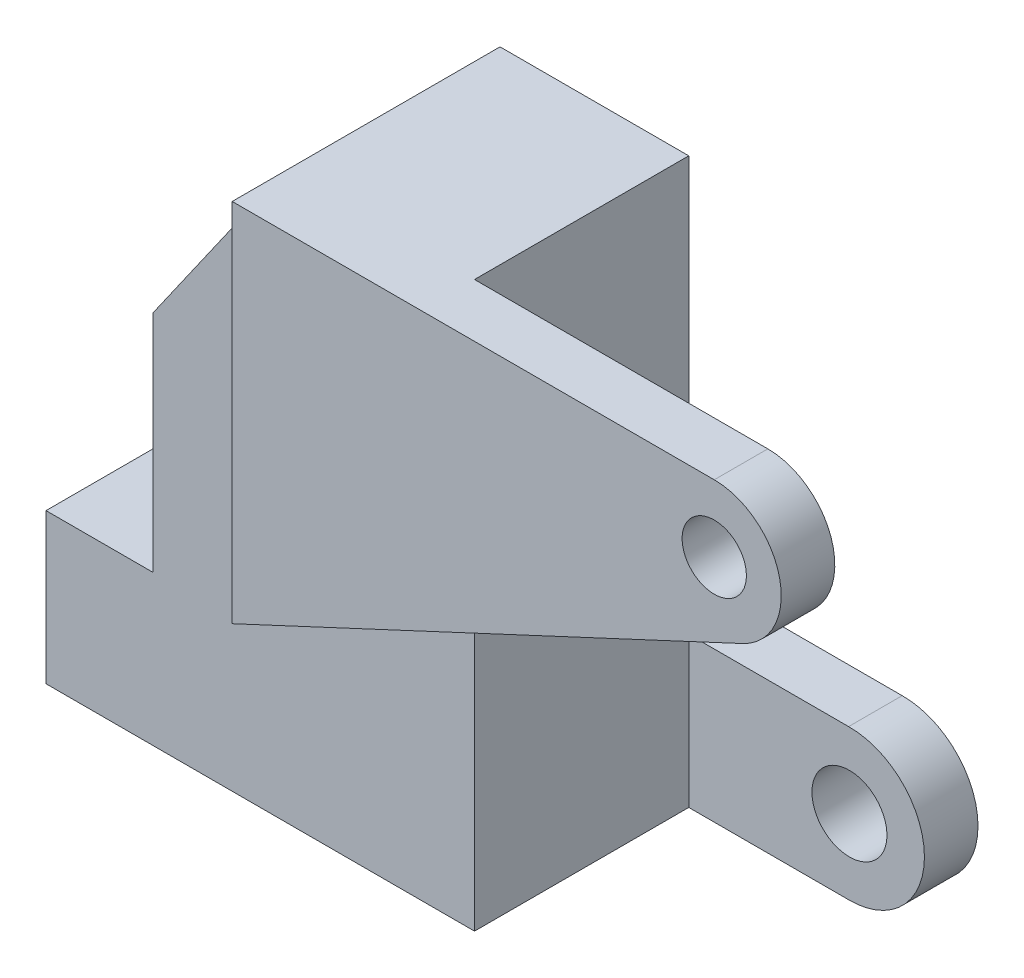
from build123d import *

# Parameters (mm, degrees)
DODANIE_WYCI_GNI_CIE1_DEPTH = 20
SZKIC2_R                    = 3.5
DODANIE_WYCI_GNI_CIE2_DEPTH = 5
SZKIC3_R                    = 3
DODANIE_WYCI_GNI_CIE3_DEPTH = 5


with BuildPart() as part:
    # Szkic1 → Dodanie-wyciągnięcie1 (new body)
    with BuildSketch(Plane.XY):
        Polygon((0, 0), (40, 0), (40, 52.681400645), (22.380650018, 52.681400645), (10, 35), (10, 14), (0, 14), align=None)
    extrude(amount=DODANIE_WYCI_GNI_CIE1_DEPTH)

    # Szkic2 → Dodanie-wyciągnięcie2 (add)
    with BuildSketch(Plane(origin=(0, 0, 0), x_dir=(-1, 0, 0), z_dir=(0, 0, -1))):
        with BuildLine():
            Line((-10, 0), (-10, 14))
            Line((-10, 14), (-54.922294035, 14))
            ThreePointArc((-54.922294035, 14), (-62, 7.00043131), (-54.922294026, 0.000862629))
            Line((-54.922294026, 0.000862629), (-10, 0))
        make_face()
        with Locations((-55, 7.000431315)):
            Circle(SZKIC2_R, mode=Mode.SUBTRACT)
    extrude(amount=DODANIE_WYCI_GNI_CIE2_DEPTH)

    # Szkic3 → Dodanie-wyciągnięcie3 (add)
    with BuildSketch(Plane.XY.offset(20)):
        with BuildLine():
            Line((22.380650018, 52.681400645), (22.380650018, 18.546912235))
            Line((22.380650018, 18.546912235), (70.022924699, 40.762869771))
            ThreePointArc((70.022924699, 40.762869771), (73.484603525, 47.782460025), (67.380650018, 52.681400645))
            Line((67.380650018, 52.681400645), (22.380650018, 52.681400645))
        make_face()
        with Locations((67.380650018, 46.429246111)):
            Circle(SZKIC3_R, mode=Mode.SUBTRACT)
    extrude(amount=DODANIE_WYCI_GNI_CIE3_DEPTH)


solid = part.part
